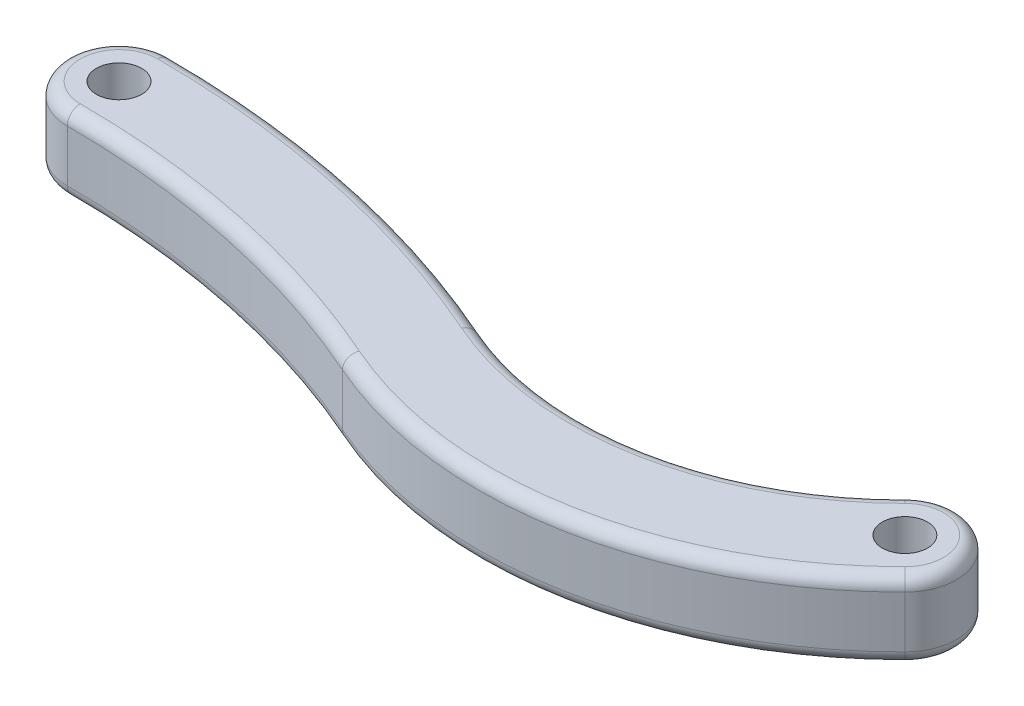
from build123d import *

# Parameters (mm, degrees)
SKETCH1_R           = 1.75
BOSS_EXTRUDE1_DEPTH = 6
FILLET1_R           = 1


with BuildPart() as part:
    # Sketch1 → Boss-Extrude1 (new body)
    with BuildSketch(Plane(origin=(0, 0, 0), x_dir=(1, 0, 0), z_dir=(0, 1, 0))):
        with BuildLine():
            ThreePointArc((-30.4, 4), (-34.4, 0), (-30.4, -4))
            ThreePointArc((-30.4, -4), (-16.617055958, -5.436924168), (-3.426888285, -9.685897488))
            ThreePointArc((-3.426888285, -9.685897488), (15.962258381, -11.93115149), (33.228427125, -2.828427125))
            ThreePointArc((33.228427125, -2.828427125), (33.228427125, 2.828427125), (27.571572875, 2.828427125))
            ThreePointArc((27.571572875, 2.828427125), (14.491142009, -4.067576182), (-0.197605466, -2.366626181))
            ThreePointArc((-0.197605466, -2.366626181), (-14.966930275, 2.391043974), (-30.4, 4))
        make_face()
        with Locations(Location((-30.4, 0, 0), (0, 0, 270))):
            Circle(SKETCH1_R, mode=Mode.SUBTRACT)
        with Locations(Location((30.4, 0, 0), (0, 0, 270))):
            Circle(SKETCH1_R, mode=Mode.SUBTRACT)
    extrude(amount=BOSS_EXTRUDE1_DEPTH)

    # Fillet1
    fillet1_edges = [part.edges().sort_by_distance(p)[0] for p in [
        (-16.617055958, 6, 5.436924168),
        (15.962258381, 6, 11.93115149),
        (33.228427125, 6, -2.828427125),
        (14.491142009, 6, 4.067576182),
        (-14.966930275, 6, -2.391043974),
        (14.491142009, 0, 4.067576182),
        (33.228427125, 0, -2.828427125),
        (15.962258381, 0, 11.93115149),
        (-16.617055958, 0, 5.436924168),
        (-34.4, 0, 0),
        (-14.966930275, 0, -2.391043974),
        (-34.4, 6, 0),
    ]]
    fillet(fillet1_edges, radius=FILLET1_R)


solid = part.part
